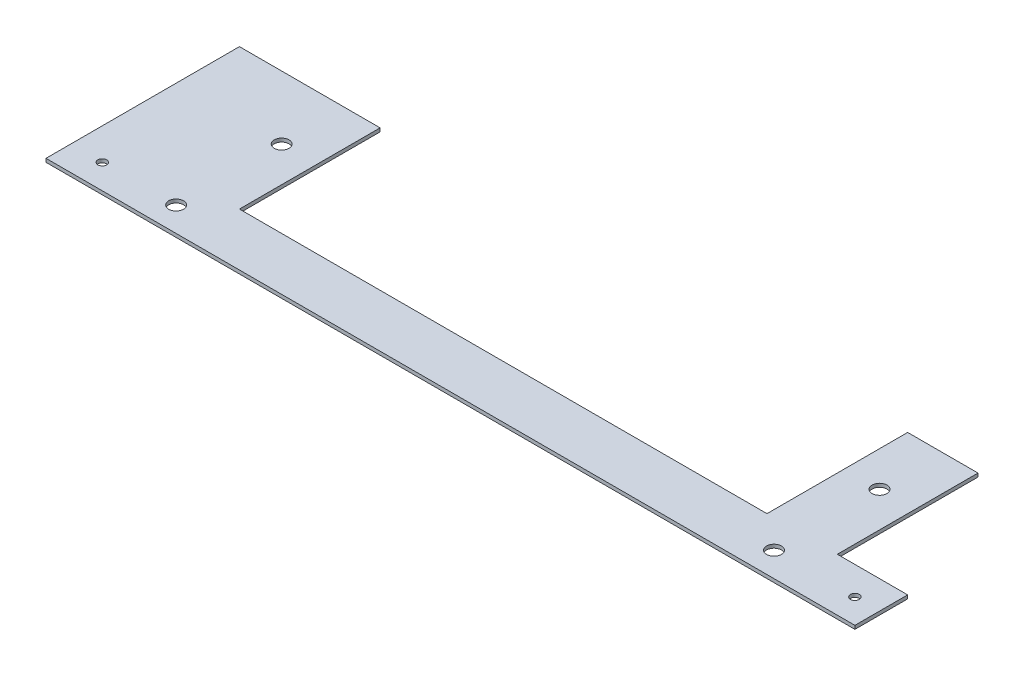
from build123d import *

# Parameters (mm, degrees)
SKETCH_1_W      = 230
SKETCH_1_H      = 1
EXTRUDE_1_DEPTH = 15
M3X0_5_1_D      = 2.5
M5X0_8_1_D      = 4.2
SKETCH_10_W     = 20
SKETCH_10_H     = 1
EXTRUDE_3_DEPTH = 40
SKETCH_11_W     = 40
SKETCH_11_H     = 1
EXTRUDE_4_DEPTH = 40
M5X0_8_3_D      = 4.2


with BuildPart() as part:
    # ｽｹｯﾁ1 → ﾎﾞｽ - 押し出し1 (new body)
    with BuildSketch(Plane.XY):
        with Locations((115, 0.5)):
            Rectangle(SKETCH_1_W, SKETCH_1_H)
    extrude(amount=EXTRUDE_1_DEPTH)

    # M3x0.5 ねじ穴1 (through all)
    with Locations(Plane(origin=(0, 0, 0), x_dir=(-1, 0, 0), z_dir=(0, -1, 0))):
        with Locations((-9, -8), (-223, -8)):
            Hole(M3X0_5_1_D / 2)

    # M5x0.8 ねじ穴1 (through all)
    with Locations(Plane(origin=(0, 1, 0), x_dir=(1, 0, 0), z_dir=(0, 1, 0))):
        with Locations((30, -8), (200, -8)):
            Hole(M5X0_8_1_D / 2)

    # ｽｹｯﾁ10 → ﾎﾞｽ - 押し出し3 (add)
    with BuildSketch(Plane(origin=(0, 0, 0), x_dir=(-1, 0, 0), z_dir=(0, 0, -1))):
        with Locations((-200, 0.5)):
            Rectangle(SKETCH_10_W, SKETCH_10_H)
    extrude(amount=EXTRUDE_3_DEPTH)

    # ｽｹｯﾁ11 → ﾎﾞｽ - 押し出し4 (add)
    with BuildSketch(Plane(origin=(0, 0, 0), x_dir=(-1, 0, 0), z_dir=(0, 0, -1))):
        with Locations((-20, 0.5)):
            Rectangle(SKETCH_11_W, SKETCH_11_H)
    extrude(amount=EXTRUDE_4_DEPTH)

    # M5x0.8 ねじ穴3 (through all)
    with Locations(Plane(origin=(0, 1, 0), x_dir=(1, 0, 0), z_dir=(0, 1, 0))):
        with Locations((30, 22), (200, 22)):
            Hole(M5X0_8_3_D / 2)


solid = part.part
